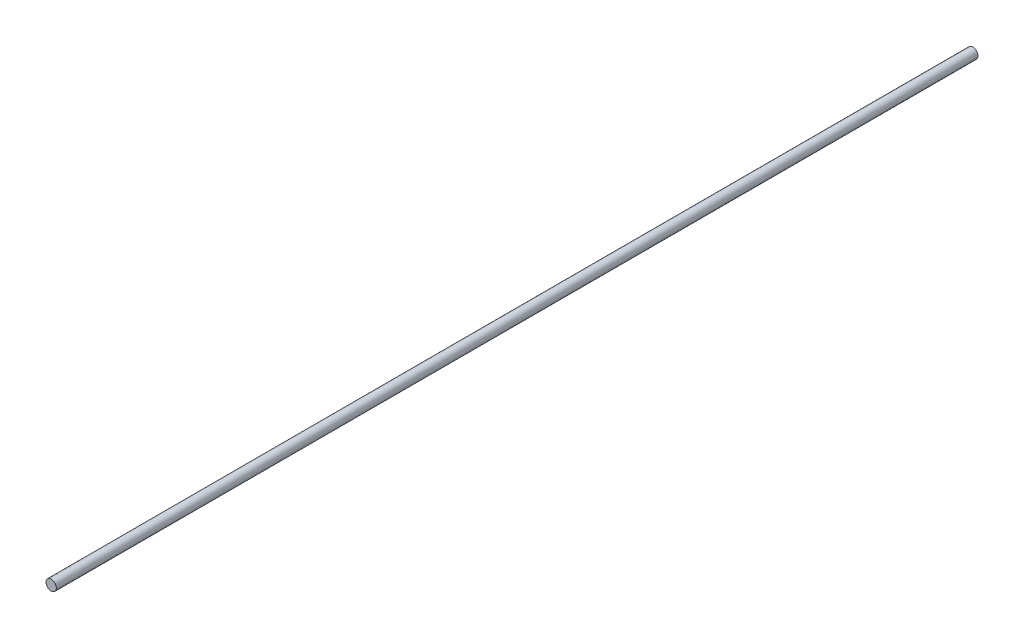
from build123d import *

# Parameters (mm, degrees)
SKETCH1_R           = 4.5
BOSS_EXTRUDE1_DEPTH = 400


with BuildPart() as part:
    # Sketch1 → Boss-Extrude1 (new, symmetric)
    with BuildSketch(Plane.XY):
        Circle(SKETCH1_R)
    extrude(amount=BOSS_EXTRUDE1_DEPTH, both=True)


solid = part.part
